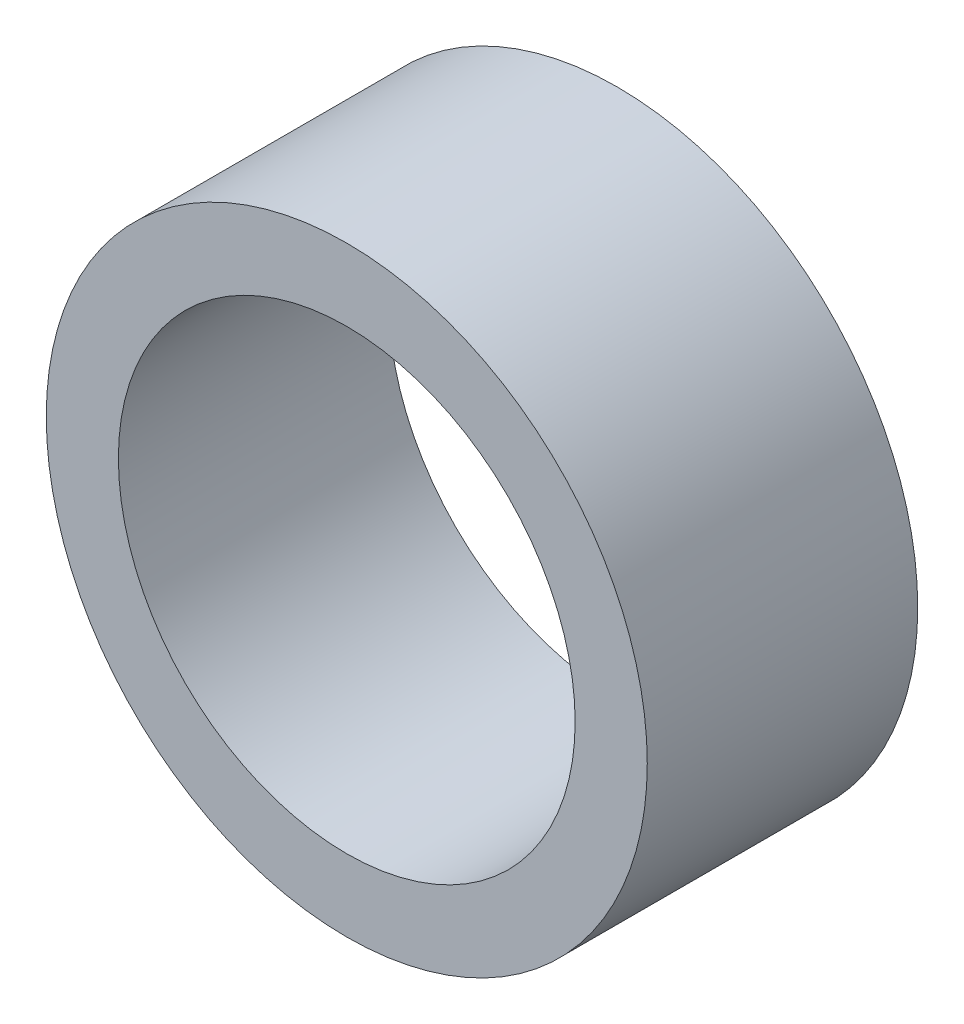
from build123d import *

# Parameters (mm, degrees)
SKETCH1_R           = 10
SKETCH1_R_2         = 7.6
BOSS_EXTRUDE1_DEPTH = 4.5


with BuildPart() as part:
    # Sketch1 → Boss-Extrude1 (new, symmetric)
    with BuildSketch(Plane.XY):
        Circle(SKETCH1_R)
        Circle(SKETCH1_R_2, mode=Mode.SUBTRACT)
    extrude(amount=BOSS_EXTRUDE1_DEPTH, both=True)


solid = part.part
